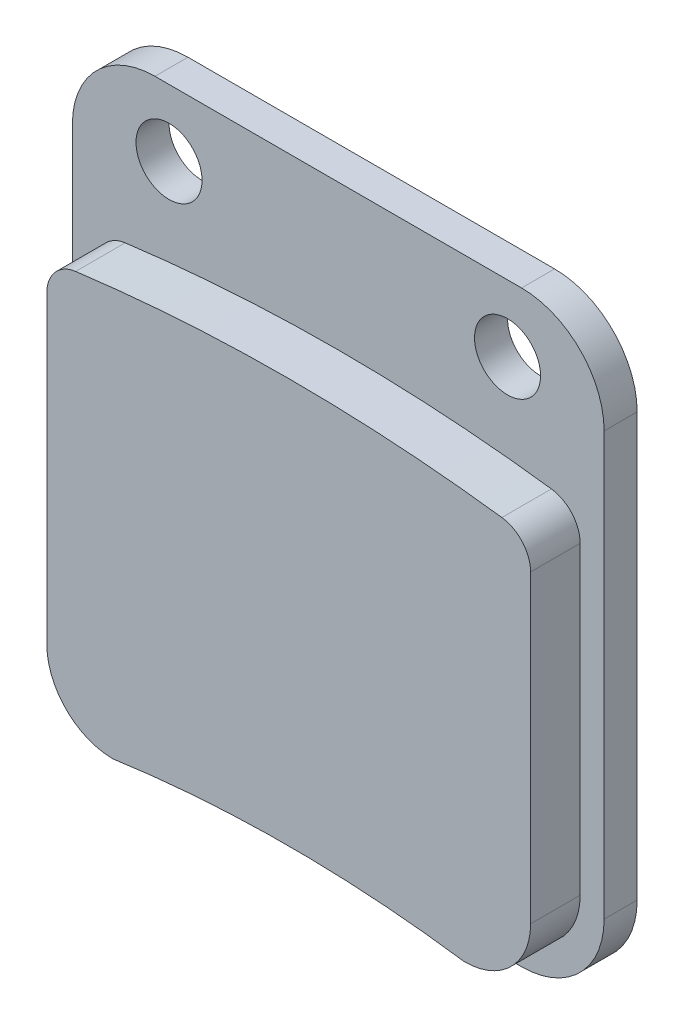
from build123d import *

# Parameters (mm, degrees)
SKETCH1_R           = 2.54
BOSS_EXTRUDE1_DEPTH = 2.54
BOSS_EXTRUDE2_DEPTH = 3.81


with BuildPart() as part:
    # Sketch1 → Boss-Extrude1 (new body)
    with BuildSketch(Plane.XY):
        with BuildLine():
            Line((-14.097, -22.606), (14.097, -22.606))
            ThreePointArc((14.097, -22.606), (18.587128061, -20.746128061), (20.447, -16.256))
            Line((20.447, -16.256), (20.447, 16.256))
            ThreePointArc((20.447, 16.256), (18.587128061, 20.746128061), (14.097, 22.606))
            Line((14.097, 22.606), (-14.097, 22.606))
            ThreePointArc((-14.097, 22.606), (-18.587128061, 20.746128061), (-20.447, 16.256))
            Line((-20.447, 16.256), (-20.447, -16.256))
            ThreePointArc((-20.447, -16.256), (-18.587128061, -20.746128061), (-14.097, -22.606))
        make_face()
        with Locations((13.0175, 17.481804688)):
            Circle(SKETCH1_R, mode=Mode.SUBTRACT)
        with Locations((-13.0175, 17.481804688)):
            Circle(SKETCH1_R, mode=Mode.SUBTRACT)
    extrude(amount=BOSS_EXTRUDE1_DEPTH)

    # Sketch2 → Boss-Extrude2 (add)
    with BuildSketch(Plane.XY.offset(2.54)):
        with BuildLine():
            Line((-18.603310345, -15.583823179), (-18.603310345, 7.849049019))
            ThreePointArc((-18.603310345, 7.849049019), (-17.97174813, 9.525194962), (-16.391133005, 10.367805121))
            ThreePointArc((-16.391133005, 10.367805121), (0, 11.43), (16.391133005, 10.367805121))
            ThreePointArc((16.391133005, 10.367805121), (17.97174813, 9.525194962), (18.603310345, 7.849049019))
            Line((18.603310345, 7.849049019), (18.603310345, -15.583823179))
            ThreePointArc((18.603310345, -15.583823179), (17.094874343, -19.189362325), (13.472365536, -20.656577934))
            ThreePointArc((13.472365536, -20.656577934), (-0.025728715, -19.705190714), (-13.523310345, -20.663823179))
            ThreePointArc((-13.523310345, -20.663823179), (-17.115412793, -19.175925628), (-18.603310345, -15.583823179))
        make_face()
    extrude(amount=BOSS_EXTRUDE2_DEPTH)


solid = part.part
